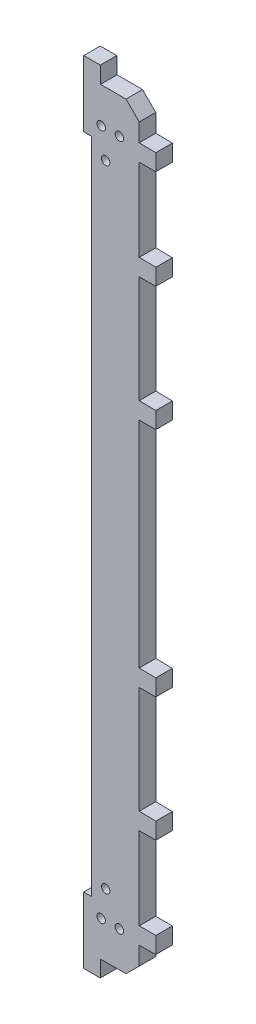
from build123d import *

# Parameters (mm, degrees)
SKETCH_1_R      = 2.55
EXTRUDE_1_DEPTH = 10


with BuildPart() as part:
    # Эскиз1 → Бобышка-Вытянуть1 (new body)
    with BuildSketch(Plane.XY):
        Polygon((-16.978606932, 199), (-16.978606932, -199), (-21.7993057, -199), (-21.7993057, -229), (-21.765949224, -238.9986114), (-11.765949224, -238.9986114), (-11.5993057, -229), (3.800694299, -229), (11.800694299, -221), (11.800694299, -210.1), (21.7993057, -209.933356475), (21.7993057, -199.933356475), (11.8006943, -199.899999999), (11.8006943, -173.449999999), (11.8006943, -150.1), (21.799305701, -150.066643523), (21.799305701, -140.066643523), (11.8006943, -139.899999999), (11.8006943, -105.949999999), (11.8006943, -75.099999999), (21.7993057, -75.066643523), (21.7993057, -65.066643523), (11.8006943, -64.899999999), (11.8006943, 64.900000001), (21.7993057, 64.933356477), (21.7993057, 74.933356477), (11.8006943, 75.100000001), (11.8006943, 109.050000001), (11.8006943, 139.900000001), (21.7993057, 139.933356477), (21.7993057, 149.933356477), (11.8006943, 150.100000001), (11.8006943, 176.550000001), (11.8006943, 199.900000001), (21.7993057, 199.933356477), (21.7993057, 209.933356477), (11.8006943, 210.100000001), (11.8006943, 221), (3.8006943, 229), (-11.599305699, 229), (-11.765949224, 238.9986114), (-21.765949224, 238.9986114), (-21.7993057, 229), (-21.7993057, 199), align=None)
        with Locations((-11.199305701, -207.5)):
            Circle(SKETCH_1_R, mode=Mode.SUBTRACT)
        with Locations((-11.199305701, 207.5)):
            Circle(SKETCH_1_R, mode=Mode.SUBTRACT)
        with Locations((-0.199305701, 207.5)):
            Circle(SKETCH_1_R, mode=Mode.SUBTRACT)
        with Locations((-8.488839347, 190.647208967)):
            Circle(SKETCH_1_R, mode=Mode.SUBTRACT)
        with Locations((-0.199305701, -207.5)):
            Circle(SKETCH_1_R, mode=Mode.SUBTRACT)
        with Locations((-8.488839347, -190.65)):
            Circle(SKETCH_1_R, mode=Mode.SUBTRACT)
    extrude(amount=EXTRUDE_1_DEPTH)


solid = part.part
